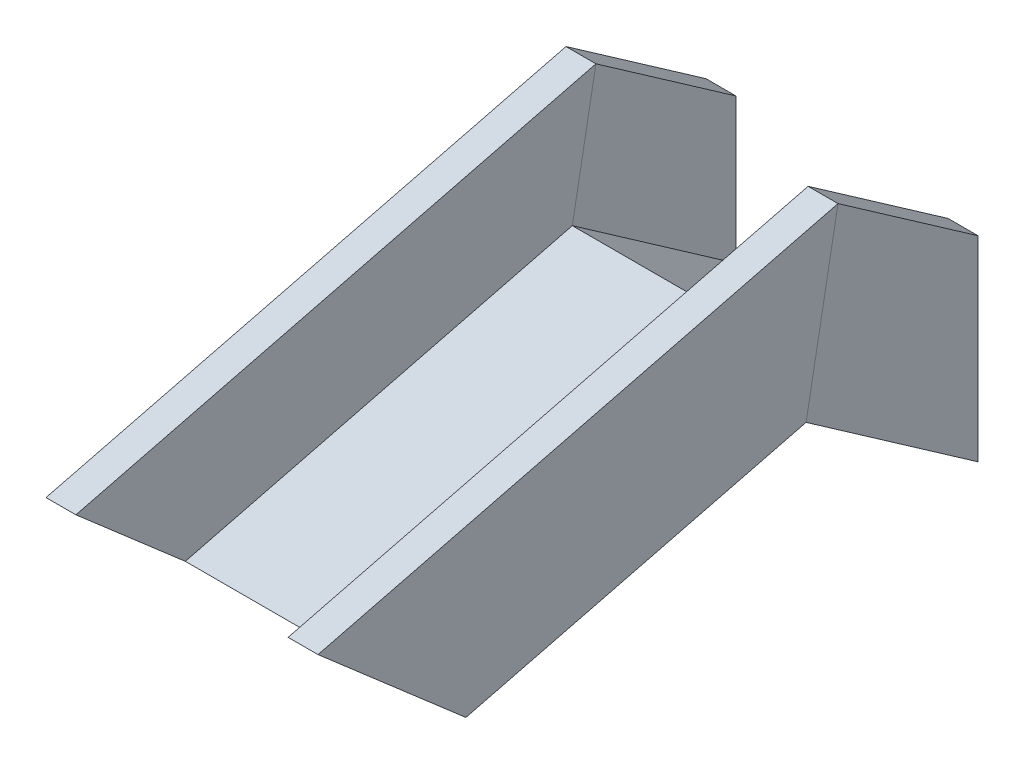
from build123d import *


with BuildPart() as part:
    # Sweep1: sweep along a path in Sketch2
    with BuildLine(Plane(origin=(0, 0, 0), x_dir=(0, 0, -1), z_dir=(1, 0, 0))) as sweep1_path:
        Line((0, 0), (-32.104520915, 22.431507437))
        Line((-32.104520915, 22.431507437), (-95.645680379, 6.47418981))
    # Sketch1 → Sweep1 (sweep)
    with BuildSketch(Plane.XY):
        Polygon((0, 0), (0, 36.574241376), (5.586518969, 36.574241376), (5.586518969, 9.514540119), (45.215887907, 9.514540119), (45.215887907, 36.574241376), (50.802406876, 36.574241376), (50.802406876, 0), align=None)
    sweep(path=sweep1_path.line, transition=Transition.RIGHT)


solid = part.part
